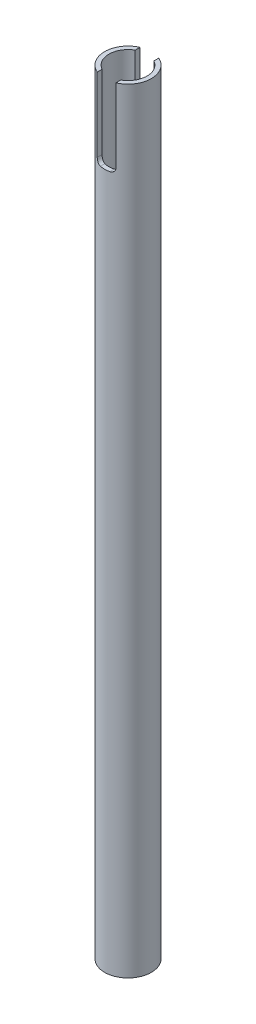
from build123d import *

# Parameters (mm, degrees)
BOSS_EXTRUDE1_START     = -124.460533
SKETCH1_R               = 7.9375
SKETCH1_R_2             = 6.4643
BOSS_EXTRUDE1_DEPTH     = 262.952371617
CUT_EXTRUDE1_DEPTH      = 139.946022527
CUT_EXTRUDE1_DEPTH_BACK = 139.946022527


with BuildPart() as part:
    # Sketch1 → Boss-Extrude1 (new body)
    with BuildSketch(Plane(origin=(0, 0, 0), x_dir=(1, 0, 0), z_dir=(0, 1, 0)).offset(BOSS_EXTRUDE1_START)):
        with Locations(Location((0, 0, 0), (0, 0, 270))):
            Circle(SKETCH1_R)
        with Locations(Location((0, 0, 0), (0, 0, 270))):
            Circle(SKETCH1_R_2, mode=Mode.SUBTRACT)
    extrude(amount=BOSS_EXTRUDE1_DEPTH)

    # Sketch2 → Cut-Extrude1 (cut, two sides: drawn at the far end of the back side and taken through both)
    with BuildSketch(Plane.XY.offset(-CUT_EXTRUDE1_DEPTH_BACK)):
        with BuildLine():
            Line((-3.175, 138.491838411), (3.175, 138.491838411))
            Line((3.175, 138.491838411), (3.175, 113.409338411))
            ThreePointArc((3.175, 113.409338411), (2.710032015, 112.286806396), (1.5875, 111.821838411))
            Line((1.5875, 111.821838411), (-1.5875, 111.821838411))
            ThreePointArc((-1.5875, 111.821838411), (-2.710032015, 112.286806396), (-3.175, 113.409338411))
            Line((-3.175, 113.409338411), (-3.175, 138.491838411))
        make_face()
    extrude(amount=CUT_EXTRUDE1_DEPTH + CUT_EXTRUDE1_DEPTH_BACK, mode=Mode.SUBTRACT)


solid = part.part
